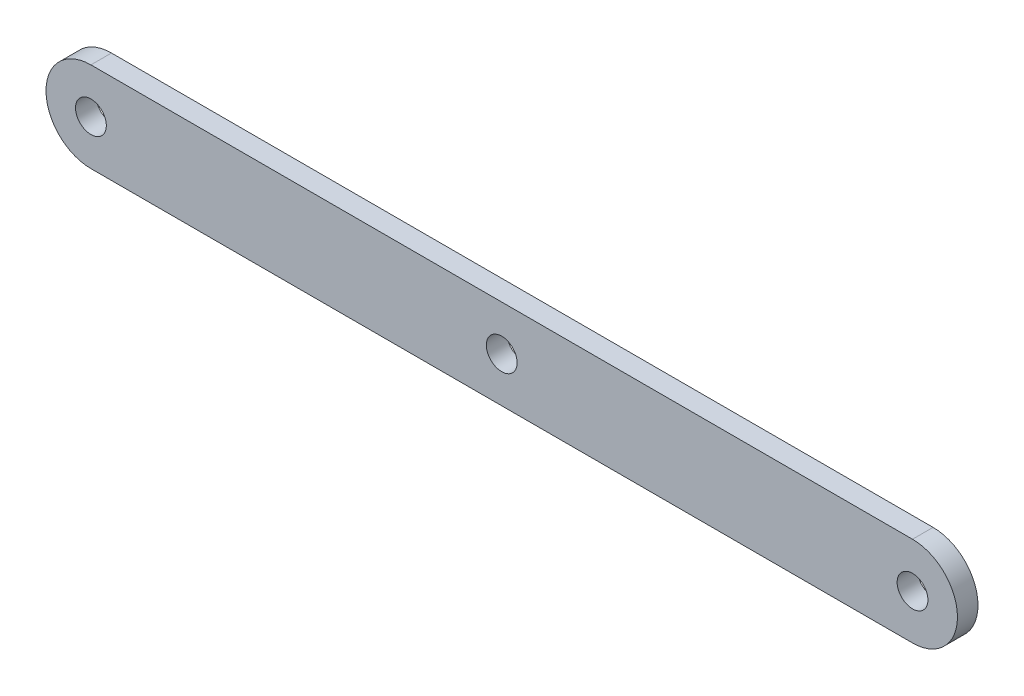
from build123d import *

# Parameters (mm, degrees)
SKETCH2_R           = 30
BOSS_EXTRUDE1_DEPTH = 40


with BuildPart() as part:
    # Sketch2 → Boss-Extrude1 (new body)
    with BuildSketch(Plane.XY):
        with BuildLine():
            Line((-93.589494877, 77.217674204), (1506.410505123, 77.217674204))
            ThreePointArc((1506.410505123, 77.217674204), (1593.910505123, -10.282325796), (1506.410505123, -97.782325796))
            Line((1506.410505123, -97.782325796), (-93.589494877, -97.782325796))
            ThreePointArc((-93.589494877, -97.782325796), (-181.089494877, -10.282325796), (-93.589494877, 77.217674204))
        make_face()
        with Locations((-93.589494877, -10.282325796)):
            Circle(SKETCH2_R, mode=Mode.SUBTRACT)
        with Locations((1506.410505123, -10.282325796)):
            Circle(SKETCH2_R, mode=Mode.SUBTRACT)
        with Locations((706.410505123, -10.282325796)):
            Circle(SKETCH2_R, mode=Mode.SUBTRACT)
    extrude(amount=BOSS_EXTRUDE1_DEPTH)


solid = part.part
